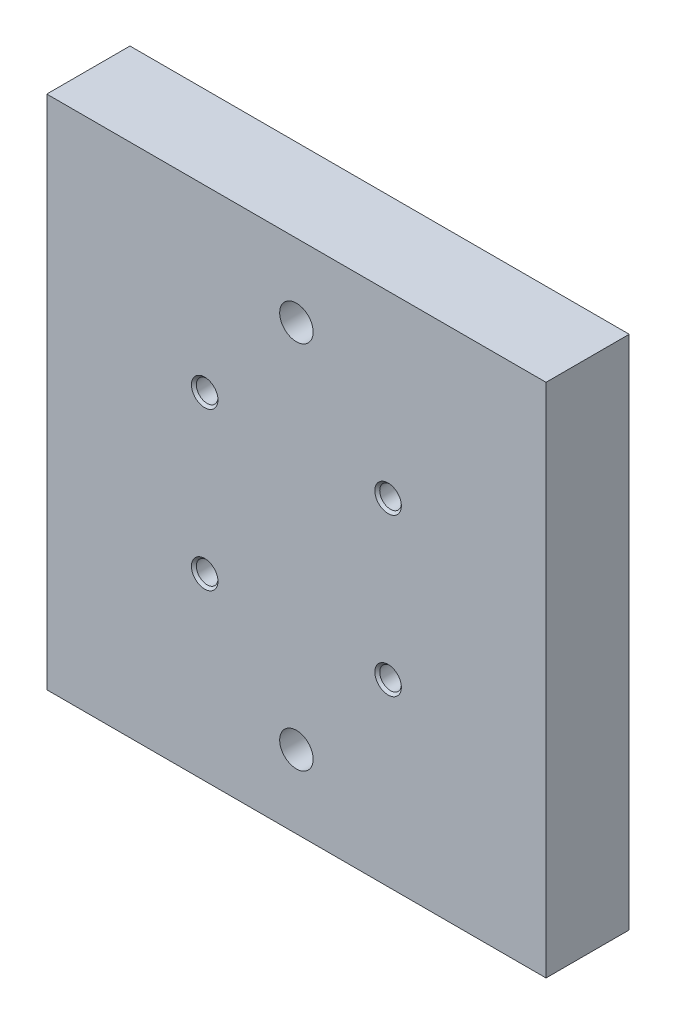
from build123d import *

# Parameters (mm, degrees)
SKETCH1_W                         = 76.2
SKETCH1_H                         = 78.74
BOSS_EXTRUDE1_DEPTH               = 12.7
F_1_4_20_TAPPED_HOLE1_D           = 5.1054
F_1_4_20_TAPPED_HOLE1_CSINK_D     = 7.62
F_1_4_20_TAPPED_HOLE1_CSINK_ANGLE = 90
M4_TAPPED_HOLE1_AT_2_COUNT        = 2
M4_TAPPED_HOLE1_AT_2_PITCH        = 27.9908
M4_TAPPED_HOLE1_AT_3_COUNT        = 2
M4_TAPPED_HOLE1_AT_3_PITCH        = 36.856616589
M4_TAPPED_HOLE1_AT_4_COUNT        = 2
M4_TAPPED_HOLE1_AT_4_PITCH        = 23.9776


with BuildPart() as part:
    # Sketch1 → Boss-Extrude1 (new body)
    with BuildSketch(Plane.XY):
        Rectangle(SKETCH1_W, SKETCH1_H)
    extrude(amount=BOSS_EXTRUDE1_DEPTH)

    # 1/4-20 Tapped Hole1 (through all)
    with Locations(Plane(origin=(0, 0, 0), x_dir=(-1, 0, 0), z_dir=(0, 0, -1))):
        with Locations((0, 28.2321), (0, -28.2321)):
            CounterSinkHole(F_1_4_20_TAPPED_HOLE1_D / 2, F_1_4_20_TAPPED_HOLE1_CSINK_D / 2, counter_sink_angle=F_1_4_20_TAPPED_HOLE1_CSINK_ANGLE)

    # Sketch5 → M4 Tapped Hole1 (revolve, cut)
    with BuildSketch(Plane(origin=(13.9954, 11.9888, 0), x_dir=(0, 1, 0), z_dir=(1, 0, 0))):
        Polygon((0, 0), (0, 12.7), (2.025, 12.7), (1.65, 12.325), (1.65, 0.375), (2.025, 0), align=None)
    m4_tapped_hole1 = revolve(axis=Axis((13.9954, 11.9888, -6.35), (0, 0, 1)), mode=Mode.SUBTRACT)

    # M4 Tapped Hole1 at 2: M4 Tapped Hole1 ×2
    with Locations(*[(-i * M4_TAPPED_HOLE1_AT_2_PITCH, 0, 0) for i in range(1, M4_TAPPED_HOLE1_AT_2_COUNT)]):
        add(m4_tapped_hole1, mode=Mode.SUBTRACT)

    # M4 Tapped Hole1 at 3: M4 Tapped Hole1 ×2
    with Locations(*[Vector(-0.7594511539682676, -0.6505643279002215, 0) * (i * M4_TAPPED_HOLE1_AT_3_PITCH) for i in range(1, M4_TAPPED_HOLE1_AT_3_COUNT)]):
        add(m4_tapped_hole1, mode=Mode.SUBTRACT)

    # M4 Tapped Hole1 at 4: M4 Tapped Hole1 ×2
    with Locations(*[(0, -i * M4_TAPPED_HOLE1_AT_4_PITCH, 0) for i in range(1, M4_TAPPED_HOLE1_AT_4_COUNT)]):
        add(m4_tapped_hole1, mode=Mode.SUBTRACT)


solid = part.part
